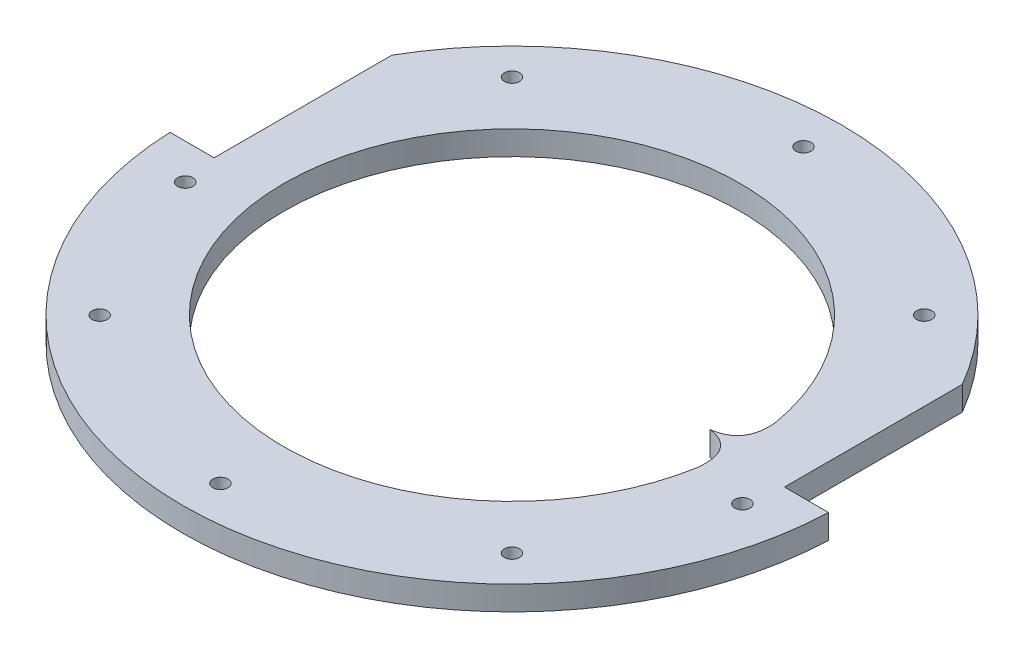
from build123d import *

# Parameters (mm, degrees)
SKETCH1_R           = 65
SKETCH1_R_2         = 1.5
BOSS_EXTRUDE1_DEPTH = 4.75
SKETCH3_W           = 10
SKETCH3_H           = 5
CUT_EXTRUDE1_DEPTH  = 5
SKETCH4_R           = 1.5
CUT_EXTRUDE2_DEPTH  = 93.012567223
CUT_EXTRUDE3_DEPTH  = 93.012567223


with BuildPart() as part:
    # Sketch1 → Boss-Extrude1 (new body)
    with BuildSketch(Plane(origin=(0, 0, 0), x_dir=(1, 0, 0), z_dir=(0, 1, 0))):
        Circle(SKETCH1_R)
        with Locations((0, -57.5)):
            Circle(SKETCH1_R_2, mode=Mode.SUBTRACT)
        with Locations((40.658639918, -40.658639918)):
            Circle(SKETCH1_R_2, mode=Mode.SUBTRACT)
        with Locations((40.658639918, 40.658639918)):
            Circle(SKETCH1_R_2, mode=Mode.SUBTRACT)
        with Locations((0, 57.5)):
            Circle(SKETCH1_R_2, mode=Mode.SUBTRACT)
        with Locations((-40.658639918, 40.658639918)):
            Circle(SKETCH1_R_2, mode=Mode.SUBTRACT)
        with Locations((-40.658639918, -40.658639918)):
            Circle(SKETCH1_R_2, mode=Mode.SUBTRACT)
        with BuildLine():
            ThreePointArc((44.349781873, 7.622128822), (-45, 0), (44.349781873, -7.622128822))
            add(Edge.make_bspline(
                [(44.349781873, -7.622128822), (45, -0.795007083), (39.088787829, 0)],
                knots=[0, 0, 0, 1, 1, 1], degree=2))
            add(Edge.make_bspline(
                [(44.349781873, 7.622128822), (45, 0.795007083), (39.088787829, 0)],
                knots=[0, 0, 0, 1, 1, 1], degree=2))
        make_face(mode=Mode.SUBTRACT)
    extrude(amount=BOSS_EXTRUDE1_DEPTH)

    # Sketch3 → Cut-Extrude1 (cut)
    with BuildSketch(Plane(origin=(0, 4.75, 0), x_dir=(1, 0, 0), z_dir=(0, 1, 0))):
        with Locations((61.25, 0)):
            Rectangle(SKETCH3_W, SKETCH3_H)
        with Locations((-61.25, 0)):
            Rectangle(SKETCH3_W, SKETCH3_H)
    extrude(amount=-CUT_EXTRUDE1_DEPTH, mode=Mode.SUBTRACT)

    # Sketch4 → Cut-Extrude2 (cut, through all)
    with BuildSketch(Plane(origin=(0, 4.75, 0), x_dir=(1, 0, 0), z_dir=(0, 1, 0))):
        with Locations((54.951905284, -9.5)):
            Circle(SKETCH4_R)
        with Locations((-54.951905284, -9.5)):
            Circle(SKETCH4_R)
    extrude(amount=-CUT_EXTRUDE2_DEPTH, mode=Mode.SUBTRACT)

    # Sketch5 → Cut-Extrude3 (cut, through all)
    with BuildSketch(Plane(origin=(0, 4.75, 0), x_dir=(1, 0, 0), z_dir=(0, 1, 0))):
        with BuildLine():
            Line((-64.951905284, 2.5), (-56.25, 2.5))
            Line((-56.25, 2.5), (-56.25, 32.572035552))
            ThreePointArc((-56.25, 32.572035552), (-62.438428004, 18.067725599), (-64.951905284, 2.5))
        make_face()
        with BuildLine():
            ThreePointArc((64.951905284, 2.5), (62.438428004, 18.067725599), (56.25, 32.572035552))
            Line((56.25, 32.572035552), (56.25, 2.5))
            Line((56.25, 2.5), (64.951905284, 2.5))
        make_face()
    extrude(amount=-CUT_EXTRUDE3_DEPTH, mode=Mode.SUBTRACT)


solid = part.part
